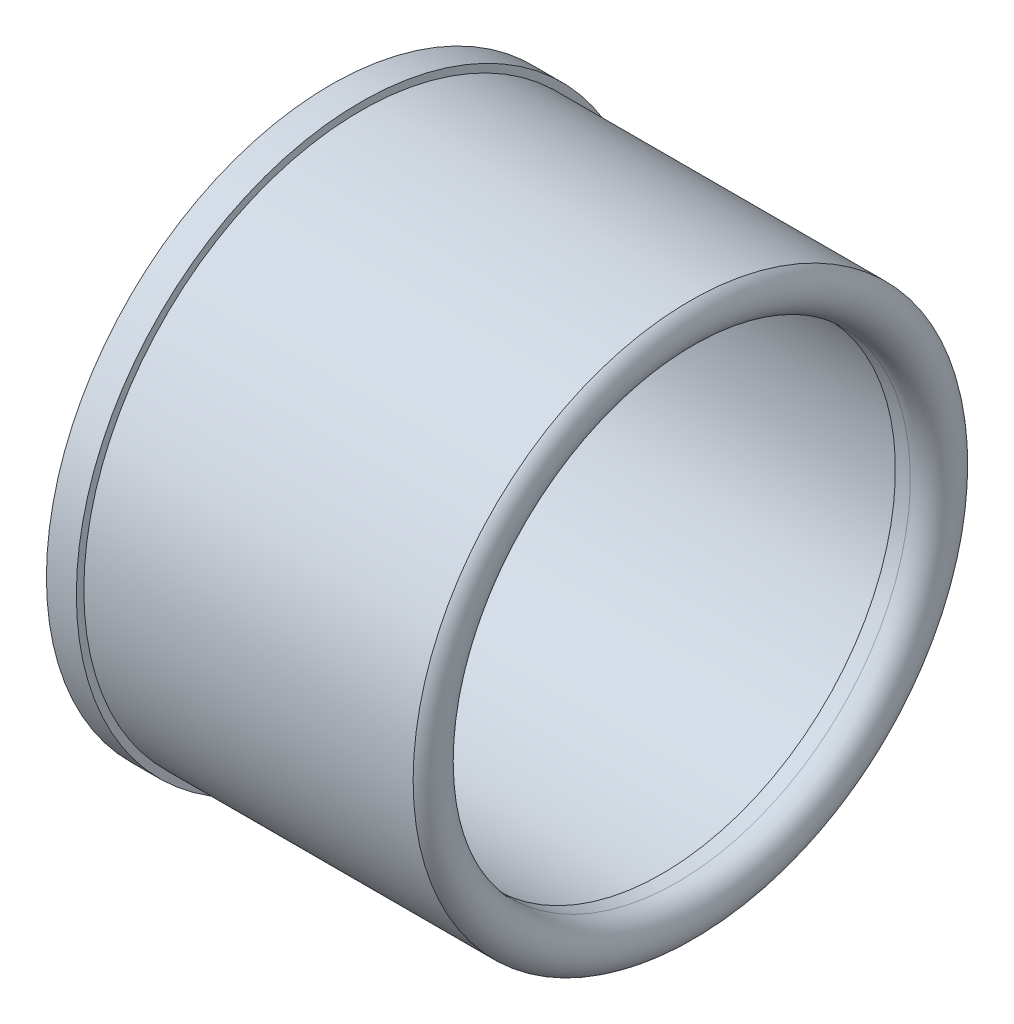
from build123d import *


with BuildPart() as part:
    # Sketch1 → Revolve1 (revolve)
    with BuildSketch(Plane(origin=(0, 0, 0), x_dir=(-1, 0, 0), z_dir=(0, 0, -1)), mode=Mode.PRIVATE) as revolve1_sk:
        with BuildLine():
            Line((-11.972812665, -0.733263235), (-11.972812665, -0.483263235))
            Line((-11.972812665, -0.483263235), (-0.912123334, -0.483263235))
            Line((-0.912123334, -0.483263235), (-0.912123334, 0.966736765))
            Line((-0.912123334, 0.966736765), (-1.912123334, 0.966736765))
            Line((-1.912123334, 0.966736765), (-1.912123334, 0.716736765))
            Line((-1.912123334, 0.716736765), (-12.912123334, 0.716736765))
            ThreePointArc((-12.912123334, 0.716736765), (-13.230357031, -0.171229021), (-12.472812665, -0.733263235))
            Line((-12.472812665, -0.733263235), (-11.972812665, -0.733263235))
        make_face()
    revolve(revolve1_sk.sketch.rotate(Axis((12.175741694, -8.533263235, 0), (-1, 0, 0)), 270), axis=Axis((12.175741694, -8.533263235, 0), (-1, 0, 0)))


solid = part.part
